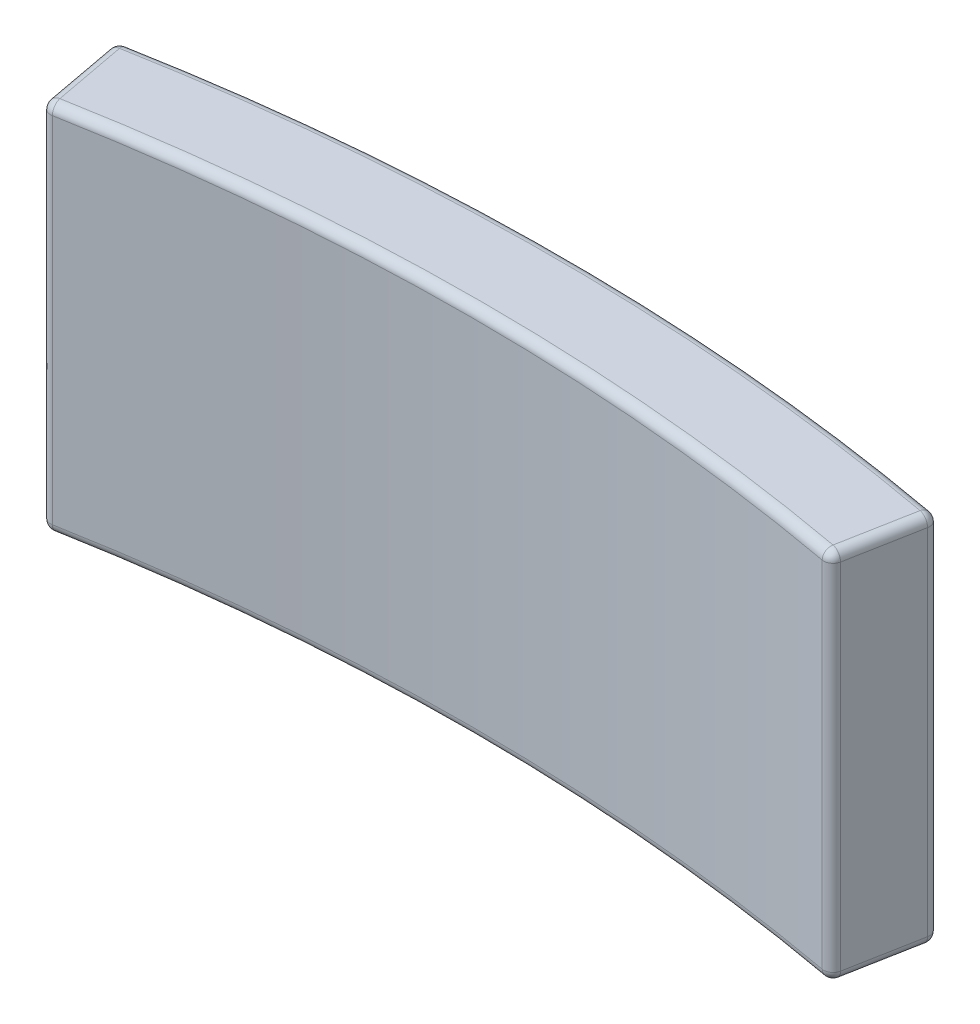
from build123d import *

# Parameters (mm, degrees)
PROFILE_DEPTH   = 2
PROFILEFILLET_R = 0.1


with BuildPart() as part:
    # ProfileS → Profile (new, symmetric)
    with BuildSketch(Plane(origin=(0, 0, 0), x_dir=(1, 0, 0), z_dir=(0, 1, 0))):
        with BuildLine():
            Line((4.22623891, 22.608381293), (4.409988428, 23.591354392))
            ThreePointArc((4.409988428, 23.591354392), (0, 24), (-4.409988428, 23.591354392))
            Line((-4.409988428, 23.591354392), (-4.22623891, 22.608381293))
            ThreePointArc((-4.22623891, 22.608381293), (0, 23), (4.22623891, 22.608381293))
        make_face()
    extrude(amount=PROFILE_DEPTH, both=True)

    # ProfileFillet
    profilefillet_edges = [part.edges().sort_by_distance(p)[0] for p in [
        (0, -2, -23),
        (-4.22623891, 0, -22.608381293),
        (-4.318113669, -2, -23.099867843),
        (4.22623891, 0, -22.608381293),
        (4.318113669, -2, -23.099867843),
        (4.318113669, 2, -23.099867843),
        (0, 2, -23),
        (-4.318113669, 2, -23.099867843),
        (4.409988428, 0, -23.591354392),
        (0, 2, -24),
        (-4.409988428, 0, -23.591354392),
        (0, -2, -24),
    ]]
    fillet(profilefillet_edges, radius=PROFILEFILLET_R)


solid = part.part
